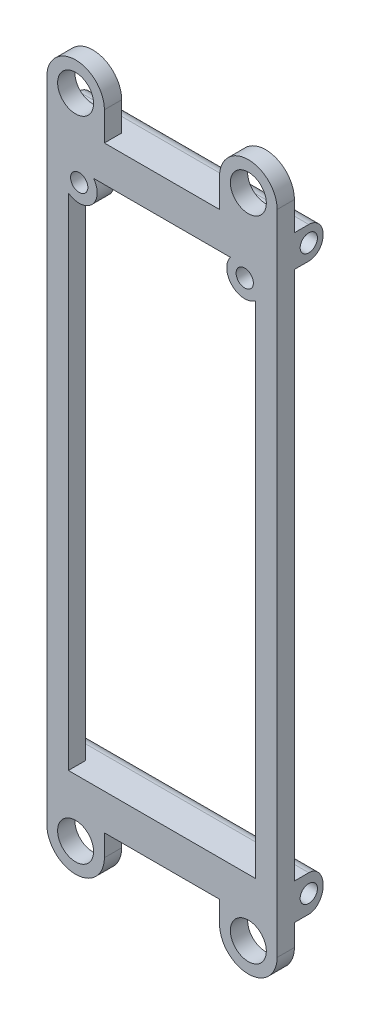
from build123d import *

# Parameters (mm, degrees)
SKETCH1_R           = 2.5
SKETCH1_W           = 26
SKETCH1_H           = 73
BOSS_EXTRUDE1_DEPTH = 2.4
BOSS_EXTRUDE2_DEPTH = 4
SKETCH4_R           = 1.2
CUT_EXTRUDE1_DEPTH  = 32
SKETCH5_R           = 1.2
CUT_EXTRUDE2_DEPTH  = 32
SKETCH6_R           = 2.5
BOSS_EXTRUDE3_DEPTH = 2.4
SKETCH7_R           = 1.2
CUT_EXTRUDE3_DEPTH  = 2.4


with BuildPart() as part:
    # Sketch1 → Boss-Extrude1 (new body)
    with BuildSketch(Plane.XY):
        with BuildLine():
            Line((8, 1), (24, 1))
            Line((24, 1), (24, 5))
            ThreePointArc((24, 5), (28, 9), (32, 5))
            Line((32, 5), (32, 0))
            Line((32, 0), (32, -80))
            Line((32, -80), (32, -85))
            ThreePointArc((32, -85), (28, -89), (24, -85))
            Line((24, -85), (24, -82))
            Line((24, -82), (8, -82))
            Line((8, -82), (8, -85))
            ThreePointArc((8, -85), (4, -89), (0, -85))
            Line((0, -85), (0, -80))
            Line((0, -80), (0, 0))
            Line((0, 0), (0, 5))
            ThreePointArc((0, 5), (4, 9), (8, 5))
            Line((8, 5), (8, 1))
        make_face()
        with Locations((4, 5)):
            Circle(SKETCH1_R, mode=Mode.SUBTRACT)
        with Locations((28, 5)):
            Circle(SKETCH1_R, mode=Mode.SUBTRACT)
        with Locations((28, -85)):
            Circle(SKETCH1_R, mode=Mode.SUBTRACT)
        with Locations((4, -85)):
            Circle(SKETCH1_R, mode=Mode.SUBTRACT)
        with Locations((16, -40.5)):
            Rectangle(SKETCH1_W, SKETCH1_H, mode=Mode.SUBTRACT)
    extrude(amount=BOSS_EXTRUDE1_DEPTH)

    # Sketch3 → Boss-Extrude2 (add)
    with BuildSketch(Plane(origin=(0, 0, 0), x_dir=(-1, 0, 0), z_dir=(0, 0, -1))):
        Polygon((0, -3.417769462), (-32, -3.417769462), (-32, 1), (-24, 1), (0, 1), align=None)
        Polygon((-29, -77), (-8, -77), (0, -77), (0, -82), (-8, -82), (-32, -82), (-32, -77), align=None)
    extrude(amount=BOSS_EXTRUDE2_DEPTH)

    # Sketch4 → Cut-Extrude1 (cut)
    with BuildSketch(Plane(origin=(32, 0, 0), x_dir=(0, 0, -1), z_dir=(1, 0, 0))):
        with Locations(Location((2, -1.208884731, 0), (0, 0, 90))):
            Circle(SKETCH4_R)
        with BuildLine():
            Line((2, 1), (3.187335187, 3.129123663))
            Line((3.187335187, 3.129123663), (6.104231783, 0.827853484))
            Line((6.104231783, 0.827853484), (6.104231783, -5.123201884))
            Line((6.104231783, -5.123201884), (2, -5.123201884))
            Line((2, -5.123201884), (2, -3.417769462))
            add(Edge.make_bspline(
                [(2, -3.417769462), (4, -3.417769462), (4, -1.208884731), (4, 1), (2, 1)],
                knots=[3.141592654, 3.141592654, 3.141592654, 4.71238898, 4.71238898, 6.283185307, 6.283185307, 6.283185307], degree=2, weights=[1, 0.707106781, 1, 0.707106781, 1]))
        make_face()
    extrude(amount=-CUT_EXTRUDE1_DEPTH, mode=Mode.SUBTRACT)

    # Sketch5 → Cut-Extrude2 (cut)
    with BuildSketch(Plane(origin=(32, 0, 0), x_dir=(0, 0, -1), z_dir=(1, 0, 0))):
        with Locations(Location((2, -79.5, 0), (0, 0, 90))):
            Circle(SKETCH5_R)
        with BuildLine():
            Line((2, -77), (2, -72.799584349))
            Line((2, -72.799584349), (8.579388068, -72.799584349))
            Line((8.579388068, -72.799584349), (8.579388068, -85.039779738))
            Line((8.579388068, -85.039779738), (2, -85.039779738))
            Line((2, -85.039779738), (2, -82))
            add(Edge.make_bspline(
                [(2, -82), (4, -82), (4, -79.5), (4, -77), (2, -77)],
                knots=[3.141592654, 3.141592654, 3.141592654, 4.71238898, 4.71238898, 6.283185307, 6.283185307, 6.283185307], degree=2, weights=[1, 0.707106781, 1, 0.707106781, 1]))
        make_face()
    extrude(amount=-CUT_EXTRUDE2_DEPTH, mode=Mode.SUBTRACT)

    # Sketch6 → Boss-Extrude3 (add)
    with BuildSketch(Plane.XY.offset(2.4)):
        with Locations((4.5, -5.5)):
            Circle(SKETCH6_R)
        with Locations((27.5, -5.5)):
            Circle(SKETCH6_R)
    extrude(amount=-BOSS_EXTRUDE3_DEPTH)

    # Sketch7 → Cut-Extrude3 (cut)
    with BuildSketch(Plane.XY.offset(2.4)):
        with Locations((4.5, -5.5)):
            Circle(SKETCH7_R)
        with Locations((27.5, -5.5)):
            Circle(SKETCH7_R)
    extrude(amount=-CUT_EXTRUDE3_DEPTH, mode=Mode.SUBTRACT)


solid = part.part
